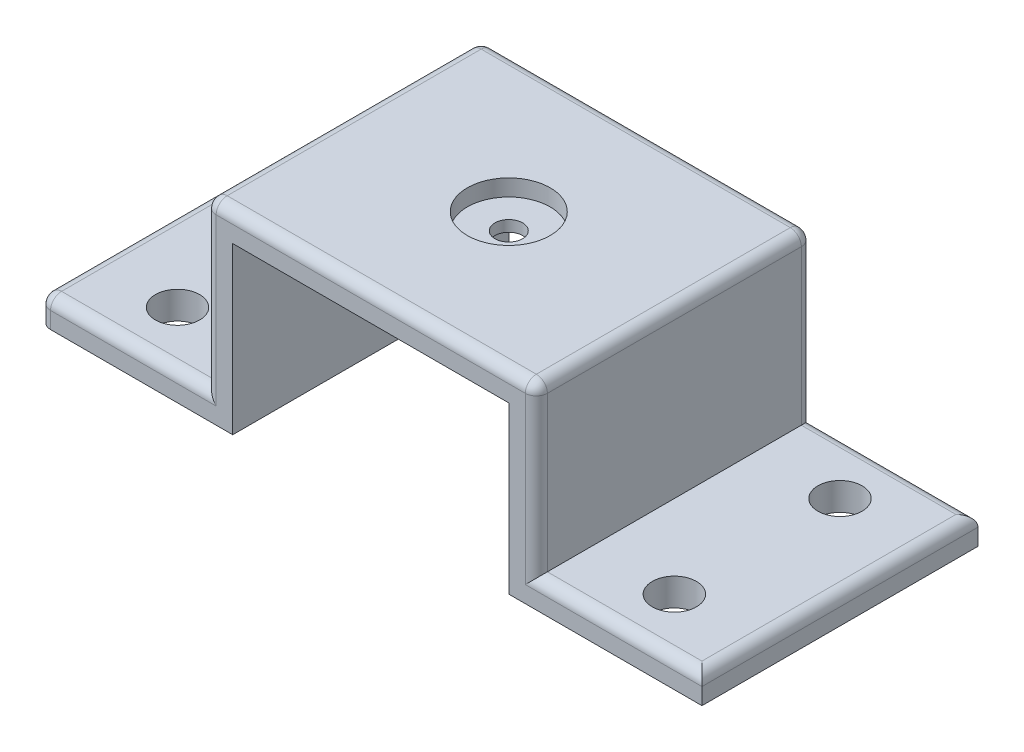
from build123d import *

# Parameters (mm, degrees)
EXTRUDE_THIN2_DEPTH                                 = 31.75
CBORE_FOR_00_BINDING_HEAD_MACHINE_SCREW_D           = 6.35
CBORE_FOR_00_BINDING_HEAD_MACHINE_SCREW_CBORE_D     = 19.05
CBORE_FOR_00_BINDING_HEAD_MACHINE_SCREW_CBORE_DEPTH = 3.81
SKETCH14_R                                          = 5.08
CUT_EXTRUDE1_DEPTH                                  = 91.918163752
LPATTERN1_COUNT                                     = 2
LPATTERN1_PITCH                                     = 38.1
LPATTERN1_COUNT_DIR2                                = 2
LPATTERN1_PITCH_DIR2                                = 114.3
FILLET1_R                                           = 2.54


with BuildPart() as part:
    # Sketch3 → Extrude-Thin2 (new, symmetric)
    with BuildSketch(Plane.XY):
        Polygon((-76.2, 38.1), (-38.1, 38.1), (-38.1, 76.2), (38.1, 76.2), (38.1, 38.1), (76.2, 38.1), (76.2, 31.75), (31.75, 31.75), (31.75, 69.85), (-31.75, 69.85), (-31.75, 31.75), (-76.2, 31.75), align=None)
    extrude(amount=EXTRUDE_THIN2_DEPTH, both=True)

    # CBORE for #00 Binding Head Machine Screw1 (through all)
    with Locations(Plane(origin=(0, 76.2, 0), x_dir=(1, 0, 0), z_dir=(0, 1, 0))):
        with Locations((0, 0)):
            CounterBoreHole(CBORE_FOR_00_BINDING_HEAD_MACHINE_SCREW_D / 2, CBORE_FOR_00_BINDING_HEAD_MACHINE_SCREW_CBORE_D / 2, CBORE_FOR_00_BINDING_HEAD_MACHINE_SCREW_CBORE_DEPTH)

    # Sketch14 → Cut-Extrude1 (cut, through all)
    with BuildSketch(Plane(origin=(0, 38.1, 0), x_dir=(1, 0, 0), z_dir=(0, 1, 0))):
        with Locations(Location((-57.15, -19.05, 0), (0, 0, 270))):
            Circle(SKETCH14_R)
    cut_extrude1 = extrude(amount=-CUT_EXTRUDE1_DEPTH, mode=Mode.SUBTRACT)

    # LPattern1: Cut-Extrude1 2 × 2
    with Locations(*[(j * LPATTERN1_PITCH_DIR2, 0, -i * LPATTERN1_PITCH) for i in range(LPATTERN1_COUNT) for j in range(LPATTERN1_COUNT_DIR2) if (i, j) != (0, 0)]):
        add(cut_extrude1, mode=Mode.SUBTRACT)

    # Fillet1
    fillet1_edges = [part.edges().sort_by_distance(p)[0] for p in [
        (-57.15, 38.1, -31.75),
        (-38.1, 57.15, -31.75),
        (0, 76.2, -31.75),
        (57.15, 38.1, 31.75),
        (38.1, 57.15, -31.75),
        (57.15, 38.1, -31.75),
        (38.1, 57.15, 31.75),
        (-76.2, 38.1, 0),
        (-38.1, 76.2, 0),
        (38.1, 76.2, 0),
        (76.2, 38.1, 0),
        (0, 76.2, 31.75),
        (-38.1, 57.15, 31.75),
        (-57.15, 38.1, 31.75),
        (-76.2, 34.925, 31.75),
    ]]
    fillet(fillet1_edges, radius=FILLET1_R)


solid = part.part
